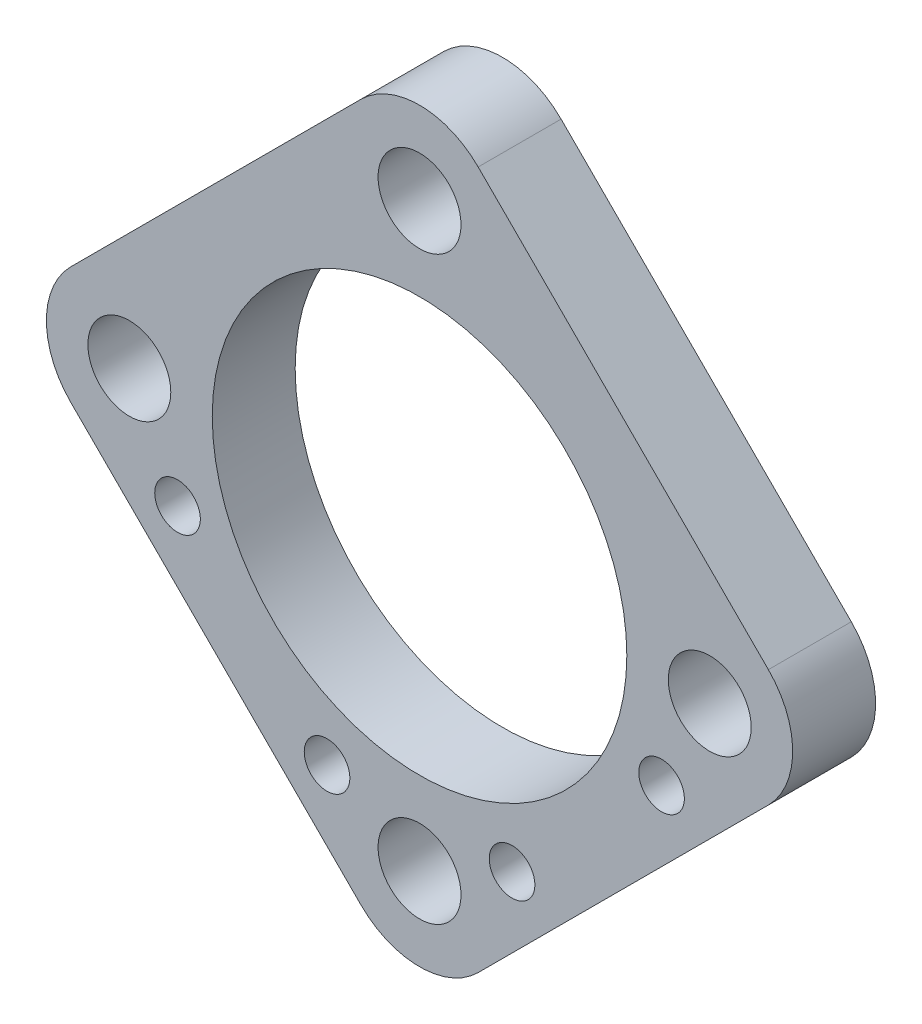
from build123d import *

# Parameters (mm, degrees)
SZKIC1_R                        = 5
SZKIC1_R_2                      = 25
DODANIE_WYCI_GNI_CIE1_DEPTH     = 10
WYTNIJ_WYCI_GNI_CIE1_DEPTH      = 65.420493634
WYTNIJ_WYCI_GNI_CIE1_DEPTH_BACK = 65.420493634
SZKIC2_R                        = 2.75


with BuildPart() as part:
    # Szkic1 → Dodanie-wyciągnięcie1 (new body)
    with BuildSketch(Plane.XY):
        with BuildLine():
            Line((-42.071067812, 7.071067812), (-7.071067812, 42.071067812))
            ThreePointArc((-7.071067812, 42.071067812), (0, 45), (7.071067812, 42.071067812))
            Line((7.071067812, 42.071067812), (42.071067812, 7.071067812))
            ThreePointArc((42.071067812, 7.071067812), (45, 0), (42.071067812, -7.071067812))
            Line((42.071067812, -7.071067812), (7.071067812, -42.071067812))
            ThreePointArc((7.071067812, -42.071067812), (0, -45), (-7.071067812, -42.071067812))
            Line((-7.071067812, -42.071067812), (-42.071067812, -7.071067812))
            ThreePointArc((-42.071067812, -7.071067812), (-45, 0), (-42.071067812, 7.071067812))
        make_face()
        with Locations((-35, 0)):
            Circle(SZKIC1_R, mode=Mode.SUBTRACT)
        with Locations((0, 35)):
            Circle(SZKIC1_R, mode=Mode.SUBTRACT)
        with Locations((35, 0)):
            Circle(SZKIC1_R, mode=Mode.SUBTRACT)
        with Locations((0, -35)):
            Circle(SZKIC1_R, mode=Mode.SUBTRACT)
        Circle(SZKIC1_R_2, mode=Mode.SUBTRACT)
    extrude(amount=DODANIE_WYCI_GNI_CIE1_DEPTH)

    # Szkic2 → Wytnij-wyciągnięcie1 (cut, two sides: drawn at the far end of the back side and taken through both)
    with BuildSketch(Plane(origin=(0, 0, 0), x_dir=(-1, 0, 0), z_dir=(0, 0, -1)).offset(-WYTNIJ_WYCI_GNI_CIE1_DEPTH_BACK)):
        with Locations((11.156854249, -29.5)):
            Circle(SZKIC2_R)
        with Locations((29.18807717, -11.46877708)):
            Circle(SZKIC2_R)
        with Locations((-11.156854249, -29.5)):
            Circle(SZKIC2_R)
        with Locations((-29.18807717, -11.46877708)):
            Circle(SZKIC2_R)
    extrude(amount=WYTNIJ_WYCI_GNI_CIE1_DEPTH + WYTNIJ_WYCI_GNI_CIE1_DEPTH_BACK, mode=Mode.SUBTRACT)


solid = part.part
